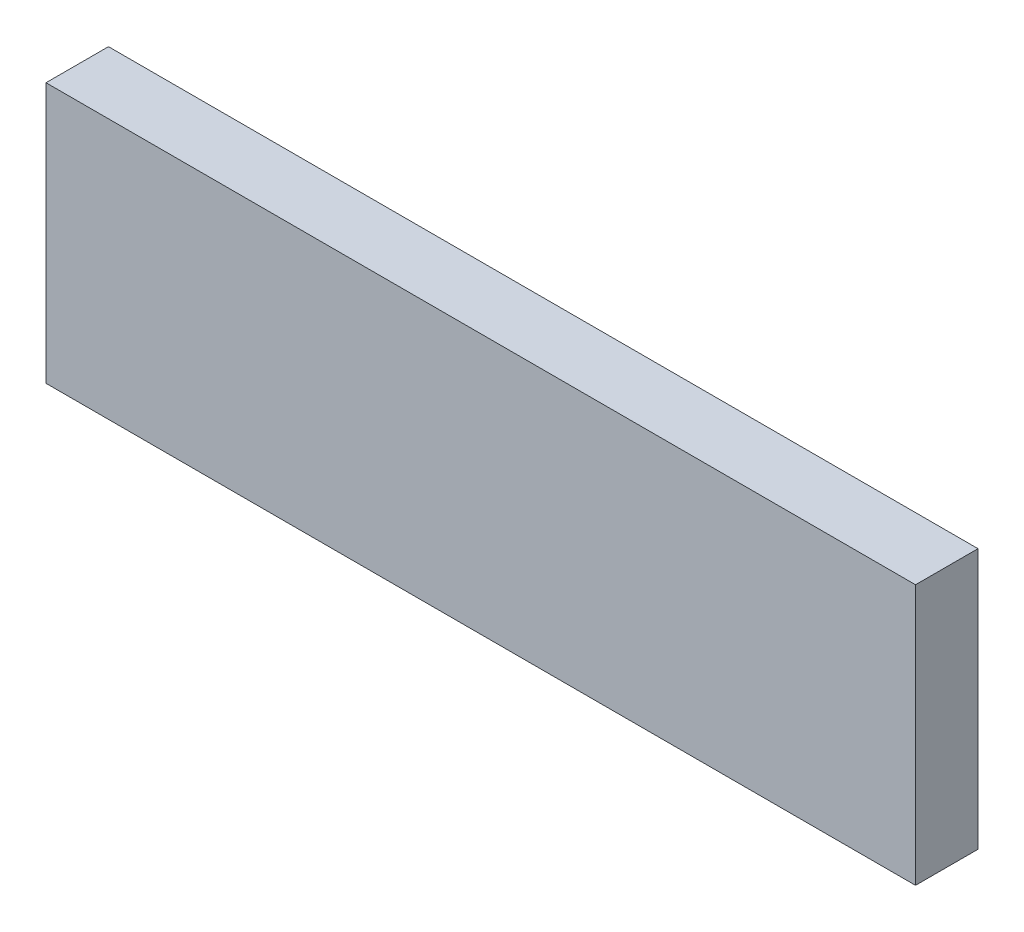
from build123d import *

# Parameters (mm, degrees)
ESBO_O1_W                = 167
ESBO_O1_H                = 50
RESSALTO_EXTRUS_O1_DEPTH = 6
ESBO_O3_R                = 3
CORTE_EXTRUS_O1_DEPTH    = 20


with BuildPart() as part:
    # Esboço1 → Ressalto-extrusão1 (new, symmetric)
    with BuildSketch(Plane.XY):
        Rectangle(ESBO_O1_W, ESBO_O1_H)
    extrude(amount=RESSALTO_EXTRUS_O1_DEPTH, both=True)

    # Esboço3 → Corte-extrusão1 (cut)
    with BuildSketch(Plane(origin=(0, -25, 0), x_dir=(-1, 0, 0), z_dir=(0, -1, 0))):
        with Locations(Location((75, 0, 0), (0, 0, 90))):
            Circle(ESBO_O3_R)
        with Locations(Location((-75, 0, 0), (0, 0, 90))):
            Circle(ESBO_O3_R)
    extrude(amount=-CORTE_EXTRUS_O1_DEPTH, mode=Mode.SUBTRACT)


solid = part.part
